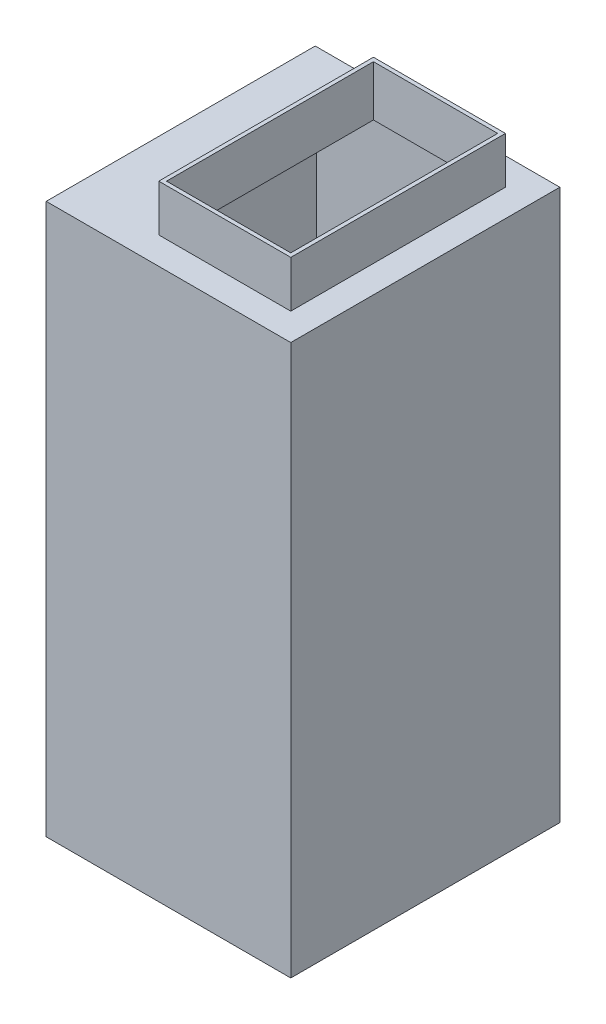
from build123d import *

# Parameters (mm, degrees)
ESQUISSE2_W             = 200
ESQUISSE2_H             = 450
BOSS_EXTRU_1_DEPTH      = 110
ESQUISSE3_W             = 193.65
ESQUISSE3_H             = 443.65
ENL_V_MAT_EXTRU_1_DEPTH = 108
ESQUISSE5_W             = 107.95
ESQUISSE5_H             = 175.55
BOSS_EXTRU_2_DEPTH      = 38.1
ESQUISSE4_W             = 101.6
ESQUISSE4_H             = 169.2
ENL_V_MAT_EXTRU_2_DEPTH = 41.275


with BuildPart() as part:
    # Esquisse2 → Boss.-Extru.1 (new, symmetric)
    with BuildSketch(Plane.XY):
        Rectangle(ESQUISSE2_W, ESQUISSE2_H)
    extrude(amount=BOSS_EXTRU_1_DEPTH, both=True)

    # Esquisse3 → Enlèv. mat.-Extru.1 (cut, symmetric)
    with BuildSketch(Plane.XY):
        Rectangle(ESQUISSE3_W, ESQUISSE3_H)
    extrude(amount=ENL_V_MAT_EXTRU_1_DEPTH, both=True, mode=Mode.SUBTRACT)

    # Esquisse5 → Boss.-Extru.2 (add)
    with BuildSketch(Plane(origin=(0, 225, 0), x_dir=(1, 0, 0), z_dir=(0, 1, 0))):
        with Locations((23.8, 0)):
            Rectangle(ESQUISSE5_W, ESQUISSE5_H)
    extrude(amount=BOSS_EXTRU_2_DEPTH)

    # Esquisse4 → Enlèv. mat.-Extru.2 (cut)
    with BuildSketch(Plane(origin=(0, 263.1, 0), x_dir=(1, 0, 0), z_dir=(0, 1, 0))):
        with Locations((23.8, 0)):
            Rectangle(ESQUISSE4_W, ESQUISSE4_H)
    extrude(amount=-ENL_V_MAT_EXTRU_2_DEPTH, mode=Mode.SUBTRACT)


solid = part.part
